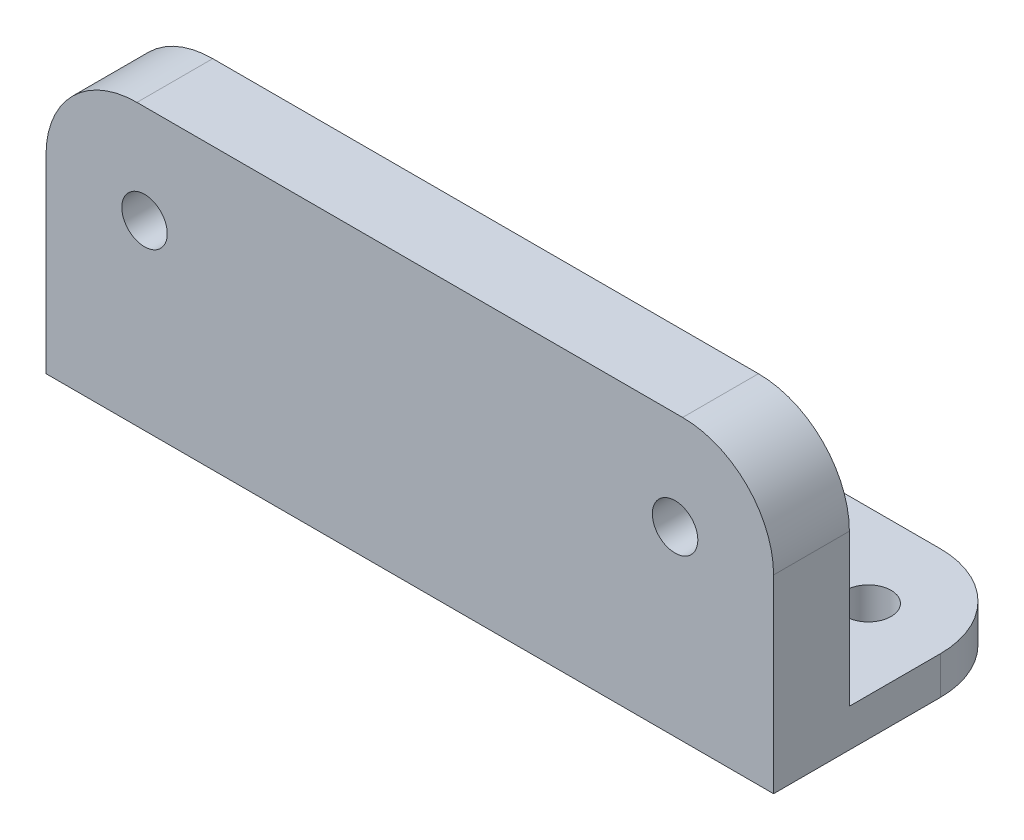
from build123d import *

# Parameters (mm, degrees)
SKETCH_1_W          = 48
SKETCH_1_H          = 17
EXTRUDE_1_DEPTH     = 2.5
SKETCH_2_W          = 48
SKETCH_2_H          = 5
EXTRUDE_2_DEPTH     = 16
SKETCH_3_R          = 1.5
CUT_EXTRUDE_1_DEPTH = 20
FILLET_1_R          = 6
SKETCH_4_R          = 1.5
CUT_EXTRUDE_2_DEPTH = 20


with BuildPart() as part:
    # 草图1 → 凸台-拉伸1 (new body)
    with BuildSketch(Plane(origin=(0, 0, 0), x_dir=(1, 0, 0), z_dir=(0, 1, 0))):
        Rectangle(SKETCH_1_W, SKETCH_1_H)
    extrude(amount=EXTRUDE_1_DEPTH)

    # 草图2 → 凸台-拉伸2 (add)
    with BuildSketch(Plane(origin=(0, 2.5, 0), x_dir=(1, 0, 0), z_dir=(0, 1, 0))):
        with Locations((0, -6)):
            Rectangle(SKETCH_2_W, SKETCH_2_H)
    extrude(amount=EXTRUDE_2_DEPTH)

    # 草图3 → 切除-拉伸1 (cut)
    with BuildSketch(Plane(origin=(0, 2.5, 0), x_dir=(1, 0, 0), z_dir=(0, 1, 0))):
        with Locations(Location((18.75, 3, 0), (0, 0, 270))):
            Circle(SKETCH_3_R)
        with Locations(Location((-18.75, 3, 0), (0, 0, 270))):
            Circle(SKETCH_3_R)
    extrude(amount=-CUT_EXTRUDE_1_DEPTH, mode=Mode.SUBTRACT)

    # 圆角1
    fillet_1_edges = [part.edges().sort_by_distance(p)[0] for p in [
        (24, 18.5, 6),
        (-24, 18.5, 6),
        (-24, 1.25, -8.5),
        (24, 1.25, -8.5),
    ]]
    fillet(fillet_1_edges, radius=FILLET_1_R)

    # 草图4 → 切除-拉伸2 (cut)
    with BuildSketch(Plane(origin=(0, 0, 3.5), x_dir=(-1, 0, 0), z_dir=(0, 0, -1))):
        with Locations((17.5, 12)):
            Circle(SKETCH_4_R)
        with Locations((-17.5, 12)):
            Circle(SKETCH_4_R)
    extrude(amount=-CUT_EXTRUDE_2_DEPTH, mode=Mode.SUBTRACT)


solid = part.part
